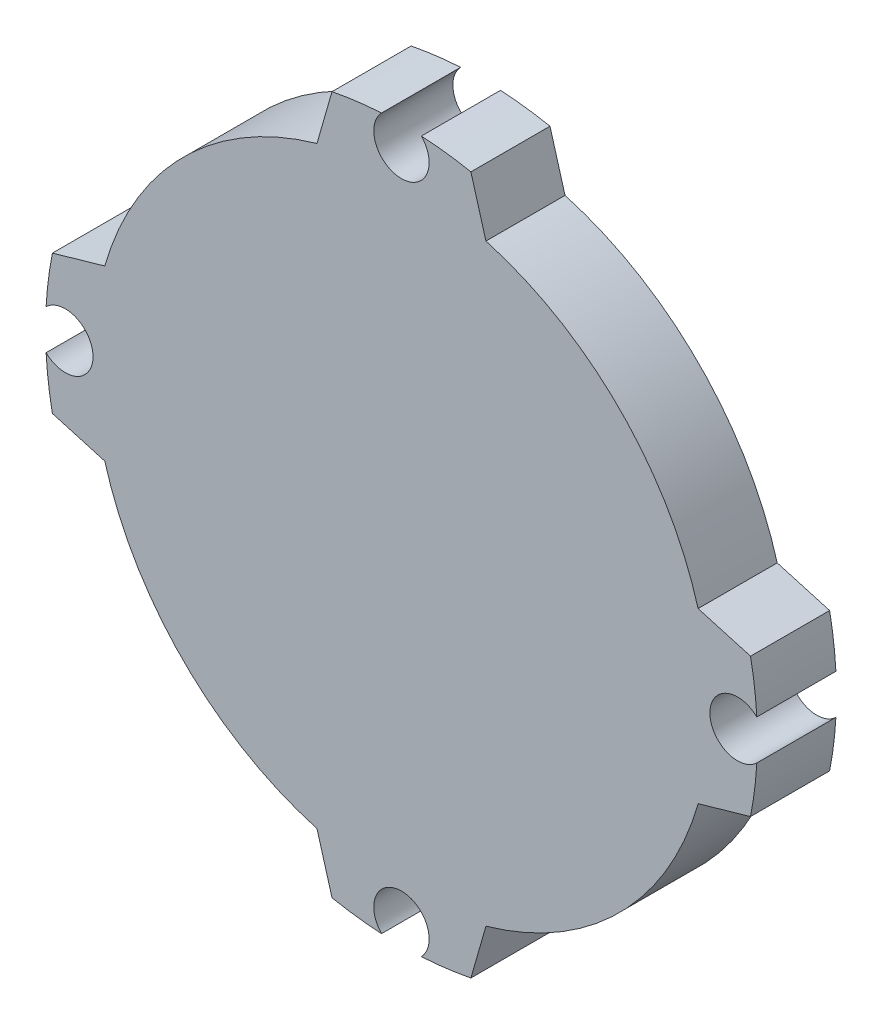
from build123d import *

# Parameters (mm, degrees)
BOSS_EXTRUDE1_DEPTH = 4


with BuildPart() as part:
    # Sketch1 → Boss-Extrude1 (new body)
    with BuildSketch(Plane.XY):
        with BuildLine():
            ThreePointArc((-9.405096609, 49.466499285), (-10.662900345, 49.351582329), (-11.909548916, 49.148743758))
            Line((-11.909548916, 49.148743758), (-12.670152398, 46.498155867))
            ThreePointArc((-12.670152398, 46.498155867), (-19.428156186, 42.525600365), (-23.400711687, 35.767596578))
            Line((-23.400711687, 35.767596578), (-26.051299579, 35.006993096))
            ThreePointArc((-26.051299579, 35.006993096), (-26.25413815, 33.760344525), (-26.369055105, 32.502540789))
            ThreePointArc((-26.369055105, 32.502540789), (-24.849782677, 32.78323576), (-23.997290399, 31.494734579))
            ThreePointArc((-23.997290399, 31.494734579), (-24.849782677, 30.206233398), (-26.369055105, 30.486928369))
            ThreePointArc((-26.369055105, 30.486928369), (-26.25413815, 29.229124633), (-26.051299579, 27.982476062))
            Line((-26.051299579, 27.982476062), (-23.400711687, 27.22187258))
            ThreePointArc((-23.400711687, 27.22187258), (-19.428156186, 20.463868792), (-12.670152398, 16.491313291))
            Line((-12.670152398, 16.491313291), (-11.909548916, 13.840725399))
            ThreePointArc((-11.909548916, 13.840725399), (-10.662900345, 13.637886829), (-9.405096609, 13.522969873))
            ThreePointArc((-9.405096609, 13.522969873), (-8.921251899, 15.792988925), (-6.997290399, 14.494734579))
            ThreePointArc((-6.997290399, 14.494734579), (-7.099036053, 13.970773079), (-7.38948419, 13.522969873))
            ThreePointArc((-7.38948419, 13.522969873), (-6.131680454, 13.637886829), (-4.885031883, 13.840725399))
            Line((-4.885031883, 13.840725399), (-4.124428401, 16.491313291))
            ThreePointArc((-4.124428401, 16.491313291), (2.633575387, 20.463868792), (6.606130888, 27.22187258))
            Line((6.606130888, 27.22187258), (9.25671878, 27.982476062))
            ThreePointArc((9.25671878, 27.982476062), (9.459557351, 29.229124633), (9.574474306, 30.486928369))
            ThreePointArc((9.574474306, 30.486928369), (7.202709601, 31.494734579), (9.574474306, 32.502540789))
            ThreePointArc((9.574474306, 32.502540789), (9.459557351, 33.760344525), (9.25671878, 35.006993096))
            Line((9.25671878, 35.006993096), (6.606130888, 35.767596578))
            ThreePointArc((6.606130888, 35.767596578), (2.633575387, 42.525600365), (-4.124428401, 46.498155867))
            Line((-4.124428401, 46.498155867), (-4.885031883, 49.148743758))
            ThreePointArc((-4.885031883, 49.148743758), (-6.131680454, 49.351582329), (-7.38948419, 49.466499285))
            ThreePointArc((-7.38948419, 49.466499285), (-8.397290399, 47.094734579), (-9.405096609, 49.466499285))
        make_face()
    extrude(amount=BOSS_EXTRUDE1_DEPTH)


solid = part.part
